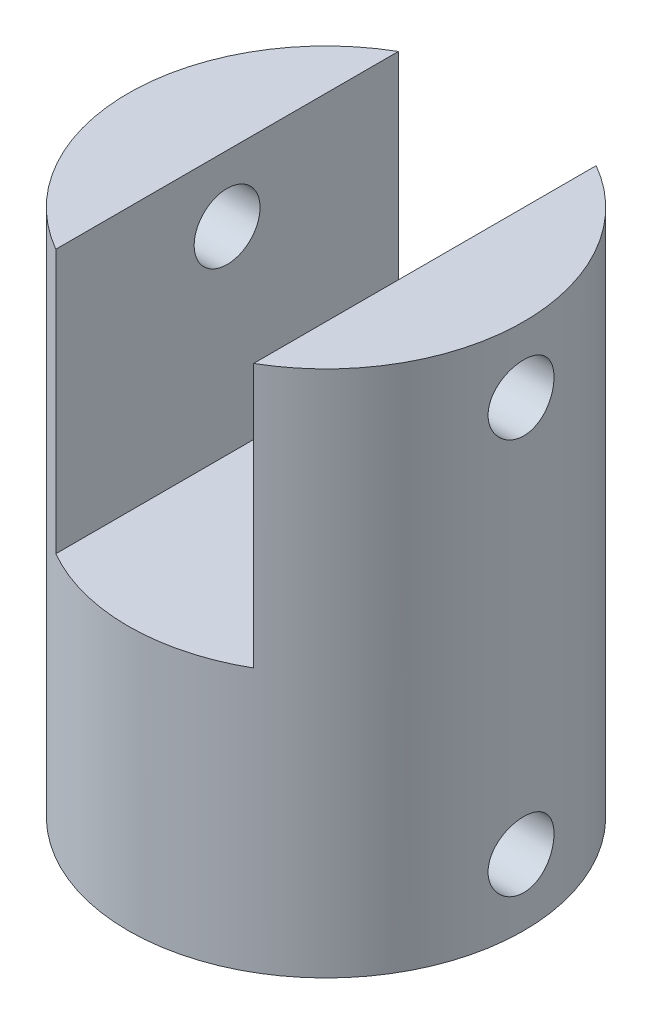
from build123d import *

# Parameters (mm, degrees)
SKETCH1_R               = 30
SKETCH1_R_2             = 15
BOSS_EXTRUDE1_DEPTH     = 80
SKETCH2_W               = 30
SKETCH2_H               = 60
CUT_EXTRUDE1_DEPTH      = 40
CUT_EXTRUDE2_DEPTH      = 97.566039579
CUT_EXTRUDE2_DEPTH_BACK = 97.566039579
SKETCH3_R               = 5
BOSS_EXTRUDE2_START     = -10
SKETCH4_R               = 15
BOSS_EXTRUDE2_DEPTH     = 10
CUT_EXTRUDE3_DEPTH      = 91.553851536
CUT_EXTRUDE3_DEPTH_BACK = 91.553851536
SKETCH5_R               = 5


with BuildPart() as part:
    # Sketch1 → Boss-Extrude1 (new body)
    with BuildSketch(Plane(origin=(0, 0, 0), x_dir=(1, 0, 0), z_dir=(0, 1, 0))):
        with Locations(Location((0, 0, 0), (0, 0, 270))):
            Circle(SKETCH1_R)
        with Locations(Location((0, 0, 0), (0, 0, 270))):
            Circle(SKETCH1_R_2, mode=Mode.SUBTRACT)
    extrude(amount=BOSS_EXTRUDE1_DEPTH)

    # Sketch2 → Cut-Extrude1 (cut)
    with BuildSketch(Plane(origin=(0, 80, 0), x_dir=(1, 0, 0), z_dir=(0, 1, 0))):
        Rectangle(SKETCH2_W, SKETCH2_H)
    extrude(amount=-CUT_EXTRUDE1_DEPTH, mode=Mode.SUBTRACT)

    # Sketch3 → Cut-Extrude2 (cut, two sides: drawn at the far end of the back side and taken through both)
    with BuildSketch(Plane(origin=(-15, 0, 0), x_dir=(0, 0, -1), z_dir=(1, 0, 0)).offset(-CUT_EXTRUDE2_DEPTH_BACK)):
        with Locations(Location((0, 70, 0), (0, 0, 270))):
            Circle(SKETCH3_R)
    extrude(amount=CUT_EXTRUDE2_DEPTH + CUT_EXTRUDE2_DEPTH_BACK, mode=Mode.SUBTRACT)

    # Sketch4 → Boss-Extrude2 (add)
    with BuildSketch(Plane(origin=(0, 40, 0), x_dir=(1, 0, 0), z_dir=(0, 1, 0)).offset(BOSS_EXTRUDE2_START)):
        with Locations(Location((0, 0, 0), (0, 0, 270))):
            Circle(SKETCH4_R)
    extrude(amount=BOSS_EXTRUDE2_DEPTH)

    # Sketch5 → Cut-Extrude3 (cut, two sides: drawn at the far end of the back side and taken through both)
    with BuildSketch(Plane(origin=(0, 0, 0), x_dir=(0, 0, -1), z_dir=(1, 0, 0)).offset(-CUT_EXTRUDE3_DEPTH_BACK)):
        with Locations((0, 10)):
            Circle(SKETCH5_R)
    extrude(amount=CUT_EXTRUDE3_DEPTH + CUT_EXTRUDE3_DEPTH_BACK, mode=Mode.SUBTRACT)


solid = part.part
